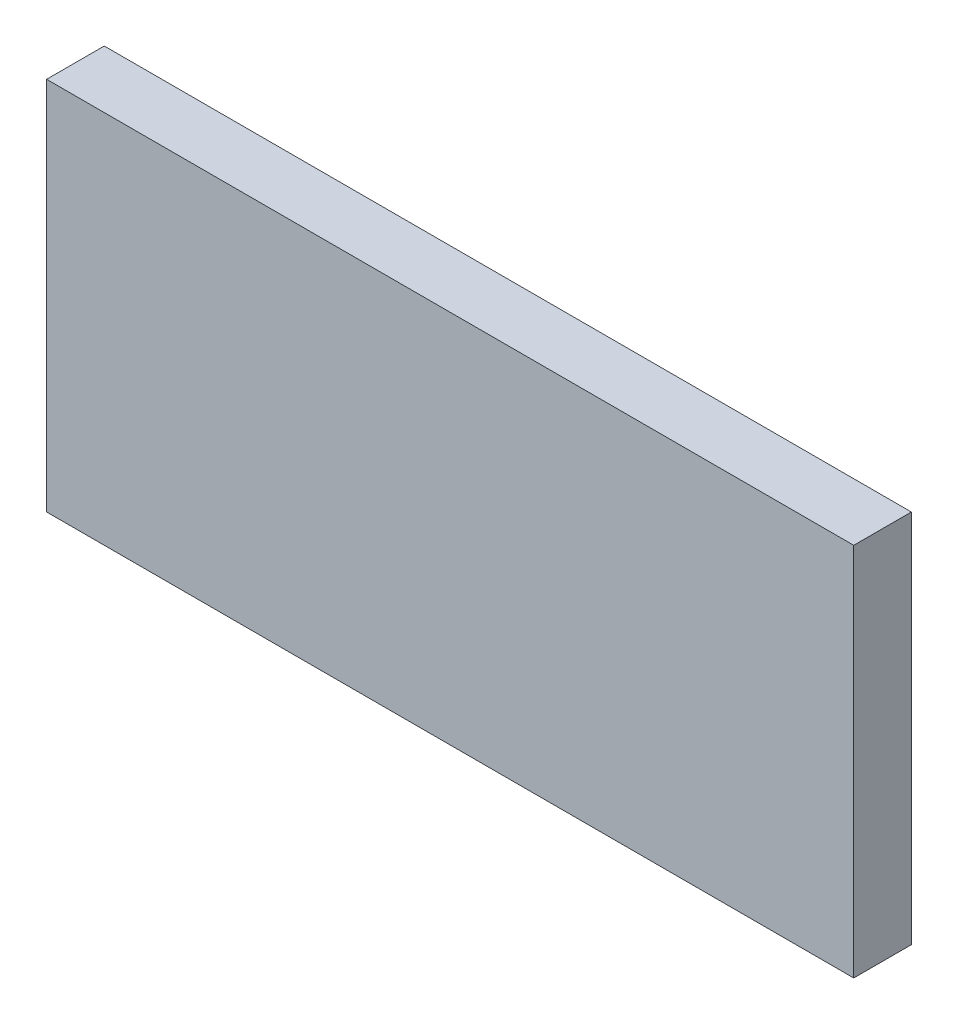
from build123d import *

# Parameters (mm, degrees)
ESQUISSE1_W        = 177.8
ESQUISSE1_H        = 82.55
BOSS_EXTRU_1_DEPTH = 12.7


with BuildPart() as part:
    # Esquisse1 → Boss.-Extru.1 (new body)
    with BuildSketch(Plane.XY):
        Rectangle(ESQUISSE1_W, ESQUISSE1_H)
    extrude(amount=BOSS_EXTRU_1_DEPTH)


solid = part.part
